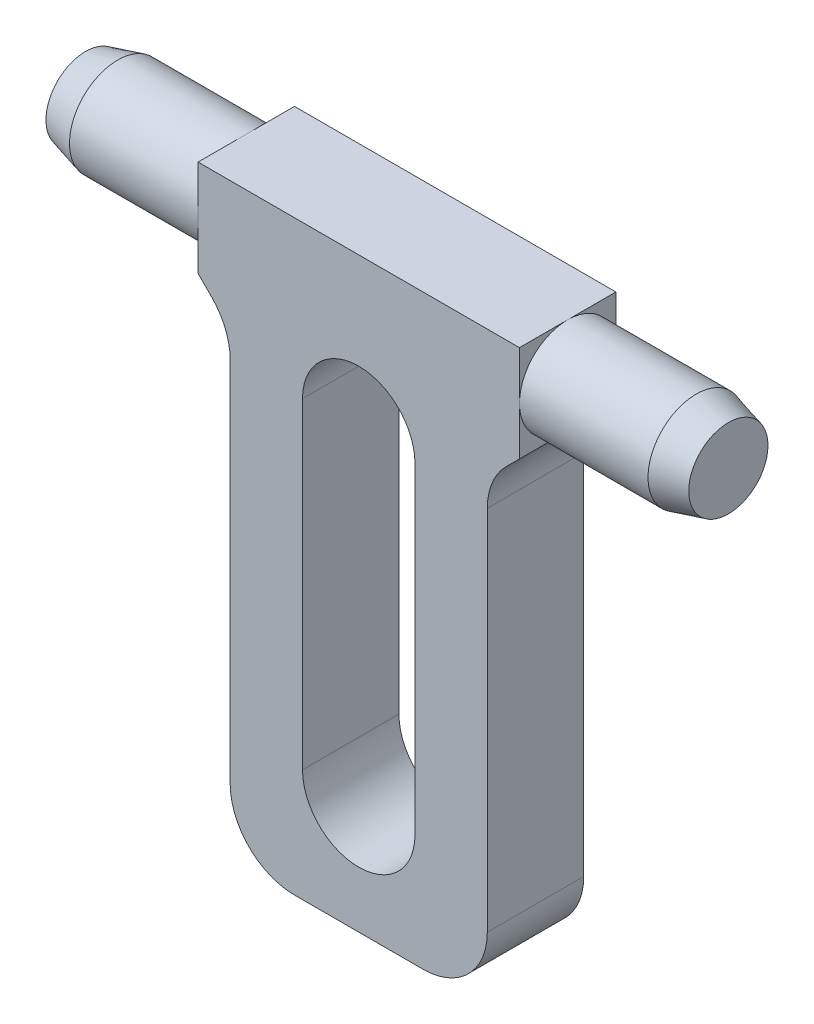
from build123d import *

# Parameters (mm, degrees)
BOSS_EXTRU_1_DEPTH = 1.5
ESQUISSE3_R        = 1.5
BOSS_EXTRU_2_DEPTH = 10


with BuildPart() as part:
    # Esquisse1 → Boss.-Extru.1 (new, symmetric)
    with BuildSketch(Plane.XY):
        with BuildLine():
            Line((-5, -1.5), (-4.585786438, -1.914213562))
            ThreePointArc((-4.585786438, -1.914213562), (-4.152240935, -2.56306026), (-4, -3.328427125))
            Line((-4, -3.328427125), (-4, -14.75))
            ThreePointArc((-4, -14.75), (-3.414213562, -16.164213562), (-2, -16.75))
            Line((-2, -16.75), (2, -16.75))
            ThreePointArc((2, -16.75), (3.414213562, -16.164213562), (4, -14.75))
            Line((4, -14.75), (4, -3.328427125))
            ThreePointArc((4, -3.328427125), (4.152240935, -2.56306026), (4.585786438, -1.914213562))
            Line((4.585786438, -1.914213562), (5, -1.5))
            Line((5, -1.5), (5, 1.5))
            Line((5, 1.5), (-5, 1.5))
            Line((-5, 1.5), (-5, -1.5))
        make_face()
        with BuildLine():
            Line((1.75, -3.25), (1.75, -13.25))
            ThreePointArc((1.75, -13.25), (0, -15), (-1.75, -13.25))
            Line((-1.75, -13.25), (-1.75, -3.25))
            ThreePointArc((-1.75, -3.25), (0, -1.5), (1.75, -3.25))
        make_face(mode=Mode.SUBTRACT)
    extrude(amount=BOSS_EXTRU_1_DEPTH, both=True)

    # Esquisse3 → Boss.-Extru.2 (add, symmetric)
    with BuildSketch(Plane(origin=(0, 0, 0), x_dir=(0, 0, -1), z_dir=(1, 0, 0))):
        Circle(ESQUISSE3_R)
    extrude(amount=BOSS_EXTRU_2_DEPTH, both=True)

    # Esquisse4 → Enlèvement de matière-Révolution1 (revolve, cut)
    with BuildSketch(Plane(origin=(0, 0, 0), x_dir=(1, 0, 0), z_dir=(0, 1, 0))):
        Polygon((-10, 1.5), (-9, 1.5), (-10, 1.232050808), align=None)
        Polygon((10, 1.232050808), (10, 1.5), (9, 1.5), align=None)
    revolve(axis=Axis((11, 0, 0), (-1, 0, 0)), mode=Mode.SUBTRACT)


solid = part.part
